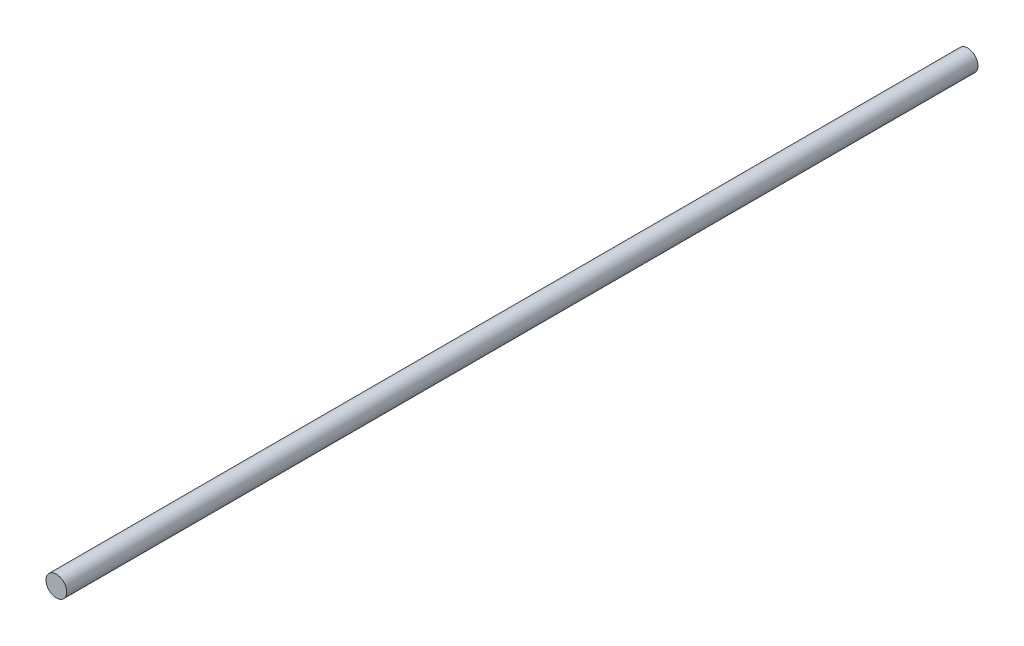
from build123d import *

# Parameters (mm, degrees)
SKETCH1_R           = 12.7
BOSS_EXTRUDE1_DEPTH = 1117.6


with BuildPart() as part:
    # Sketch1 → Boss-Extrude1 (new body)
    with BuildSketch(Plane.XY):
        Circle(SKETCH1_R)
    extrude(amount=BOSS_EXTRUDE1_DEPTH)


solid = part.part
